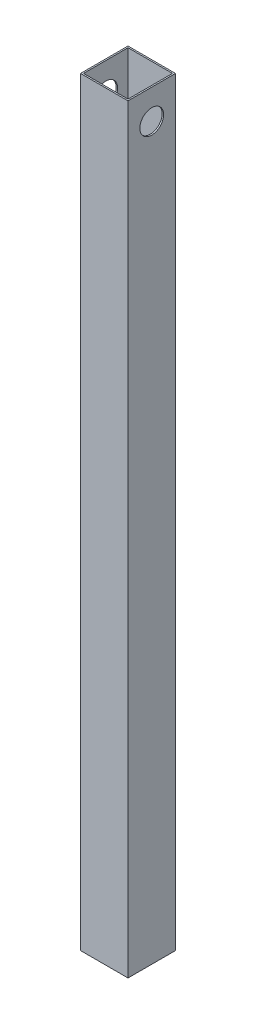
from build123d import *

# Parameters (mm, degrees)
SKETCH1_W           = 50.8
SKETCH1_H           = 50.8
BOSS_EXTRUDE1_DEPTH = 406.4
SHELL1_T            = -1.5875
SKETCH2_R           = 12.7
CUT_EXTRUDE1_DEPTH  = 413.701150956


with BuildPart() as part:
    # Sketch1 → Boss-Extrude1 (new, symmetric)
    with BuildSketch(Plane(origin=(0, 0, 0), x_dir=(1, 0, 0), z_dir=(0, 1, 0))):
        with Locations((25.4, 25.4)):
            Rectangle(SKETCH1_W, SKETCH1_H)
    extrude(amount=BOSS_EXTRUDE1_DEPTH, both=True)

    # Shell1
    shell1_openings = [part.faces().sort_by_distance(p)[0] for p in [
        (25.4, 406.4, -25.4),
        (25.4, -406.4, -25.4),
    ]]
    offset(amount=SHELL1_T, openings=shell1_openings, kind=Kind.INTERSECTION)

    # Sketch2 → Cut-Extrude1 (cut, through all)
    with BuildSketch(Plane(origin=(50.8, 0, 0), x_dir=(0, 0, -1), z_dir=(1, 0, 0))):
        with Locations((25.4, 374.65)):
            Circle(SKETCH2_R)
    extrude(amount=-CUT_EXTRUDE1_DEPTH, mode=Mode.SUBTRACT)


solid = part.part
